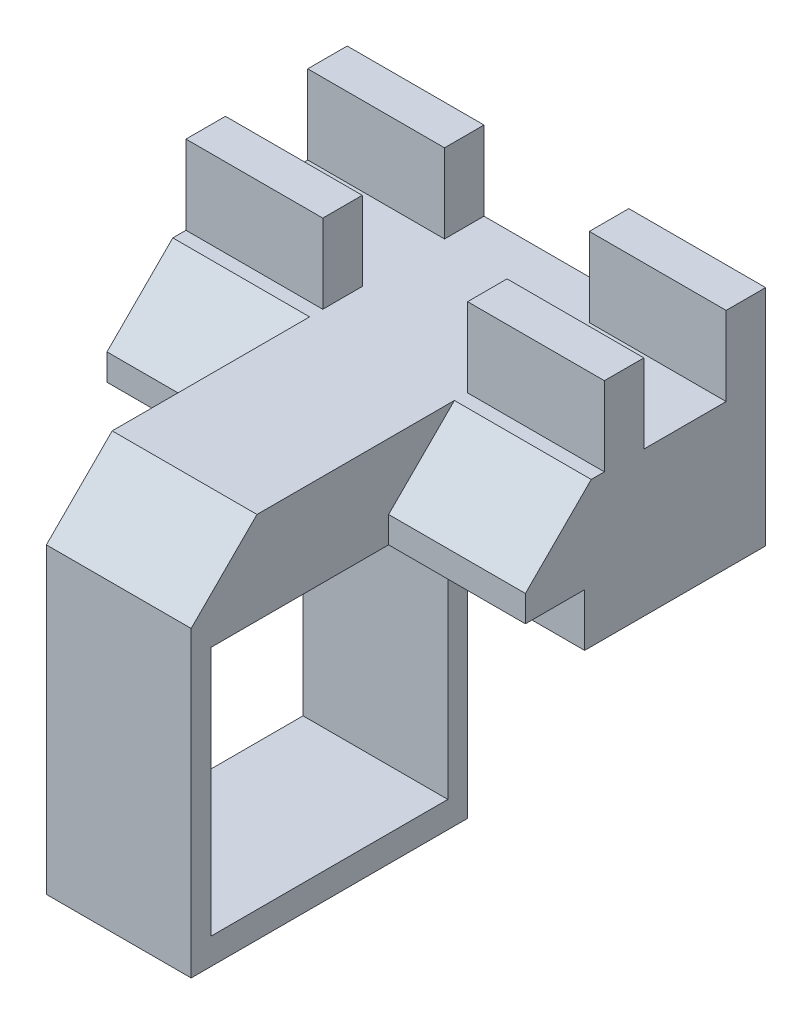
from build123d import *

# Parameters (mm, degrees)
BOSS_EXTRUDE2_DEPTH   = 23
SKETCH1_W             = 20.789980378
SKETCH1_H             = 6
BOSS_EXTRUDE2_2_DEPTH = 23
BOSS_EXTRUDE2_3_DEPTH = 23
BOSS_EXTRUDE2_4_DEPTH = 23
SKETCH1_3_W           = 20.789980378
SKETCH1_3_H           = 36.5
BOSS_EXTRUDE3_DEPTH   = 11
BOSS_EXTRUDE5_DEPTH   = 45
SKETCH2_W             = 9
SKETCH2_H             = 8
CUT_EXTRUDE1_DEPTH    = 106.353028551
SKETCH3_W             = 24.5
SKETCH3_H             = 11
BOSS_EXTRUDE6_DEPTH   = 42
BOSS_EXTRUDE7_DEPTH   = 11
CHAMFER2_SIZE         = 10


with BuildPart() as part:
    # Sketch1 → Boss-Extrude2 (new body)
    with BuildSketch(Plane(origin=(0, 0, 0), x_dir=(1, 0, 0), z_dir=(0, 1, 0))):
        Polygon((0.945063883, 6), (0.945063883, 0), (1.890127766, 0), (21.735044261, 0), (21.735044261, 6), align=None)
    extrude(amount=BOSS_EXTRUDE2_DEPTH)



with BuildPart() as body_2:
    # Sketch1 → Boss-Extrude2 2 (new body)
    with BuildSketch(Plane(origin=(0, 0, 0), x_dir=(1, 0, 0), z_dir=(0, 1, 0))):
        with Locations((11.340054072, -15.5)):
            Rectangle(SKETCH1_W, SKETCH1_H)
    extrude(amount=BOSS_EXTRUDE2_2_DEPTH)


with BuildPart() as body_3:
    # Sketch1 → Boss-Extrude2 3 (new body)
    with BuildSketch(Plane(origin=(0, 0, 0), x_dir=(1, 0, 0), z_dir=(0, 1, 0))):
        with Locations((54.13003445, -15.5)):
            Rectangle(SKETCH1_W, SKETCH1_H)
    extrude(amount=BOSS_EXTRUDE2_3_DEPTH)


with BuildPart() as body_4:
    # Sketch1 → Boss-Extrude2 4 (new body)
    with BuildSketch(Plane(origin=(0, 0, 0), x_dir=(1, 0, 0), z_dir=(0, 1, 0))):
        with Locations((54.13003445, 3)):
            Rectangle(SKETCH1_W, SKETCH1_H)
    extrude(amount=BOSS_EXTRUDE2_4_DEPTH)


with BuildPart() as part_1:
    add(part.part)

    add(body_2.part)  # Boss-Extrude3 merges body 2
    # Sketch1<3> → Boss-Extrude3 (add)
    with BuildSketch(Plane(origin=(0, 0, 0), x_dir=(1, 0, 0), z_dir=(0, 1, 0))):
        with Locations((11.340054072, -12.25)):
            Rectangle(SKETCH1_3_W, SKETCH1_3_H)
        with Locations((54.13003445, -12.25)):
            Rectangle(SKETCH1_3_W, SKETCH1_3_H)
    extrude(amount=-BOSS_EXTRUDE3_DEPTH)

    # Sketch1<6> → Boss-Extrude5 (add)
    with BuildSketch(Plane(origin=(0, 0, 0), x_dir=(1, 0, 0), z_dir=(0, 1, 0))):
        Polygon((43.735044261, -18.5), (32.735044261, -18.5), (32.735044261, -60.5), (43.735044261, -60.5), (43.735044261, -30.5), align=None)
        Polygon((32.735044261, -18.5), (21.735044261, -18.5), (21.735044261, -30.5), (21.735044261, -60.5), (32.735044261, -60.5), align=None)
    extrude(amount=-BOSS_EXTRUDE5_DEPTH)

    # Sketch2 → Cut-Extrude1 (cut, through all)
    with BuildSketch(Plane(origin=(74.525024639, 0, 0), x_dir=(0, 0, -1), z_dir=(1, 0, 0))):
        Polygon((-30.5, -11), (-30.5, -3), (-41.183889214, -3), (-57.5, -3), (-57.5, -14.989659462), (-57.5, -41), (-21.5, -41), (-21.5, -11), align=None)
        with Locations((-26, -7)):
            Rectangle(SKETCH2_W, SKETCH2_H)
    extrude(amount=-CUT_EXTRUDE1_DEPTH, mode=Mode.SUBTRACT)


    add(body_3.part)  # Boss-Extrude6 merges body 3

    add(body_4.part)  # Boss-Extrude6 merges body 4
    # Sketch3 → Boss-Extrude6 (add)
    with BuildSketch(Plane.ZY.offset(-43.735044261)):
        with Locations((6.25, -5.5)):
            Rectangle(SKETCH3_W, SKETCH3_H)
    extrude(amount=BOSS_EXTRUDE6_DEPTH)

    # Sketch4 → Boss-Extrude7 (add)
    with BuildSketch(Plane(origin=(0, 0, 0), x_dir=(1, 0, 0), z_dir=(0, 1, 0))):
        Polygon((64.525024639, -18.5), (43.735044261, -18.5), (43.735044261, -12.5), (64.525024639, -12.5), (64.525024639, 0), (43.735044261, 0), (43.735044261, 6), (21.735044261, 6), (21.735044261, 0), (0.945063883, 0), (0.945063883, -12.5), (21.735044261, -12.5), (21.735044261, -18.5), (0.945063883, -18.5), (0.945063883, -30.5), (21.735044261, -30.5), (21.735044261, -60.5), (43.735044261, -60.5), (43.735044261, -30.5), (64.525024639, -30.5), align=None)
    extrude(amount=BOSS_EXTRUDE7_DEPTH)

    # Chamfer2
    chamfer2_edges = [part_1.edges().sort_by_distance(p)[0] for p in [
        (11.340054072, 11, 30.5),
        (32.735044261, 11, 60.5),
        (54.13003445, 11, 30.5),
    ]]
    chamfer(chamfer2_edges, length=CHAMFER2_SIZE)


solid = part_1.part
